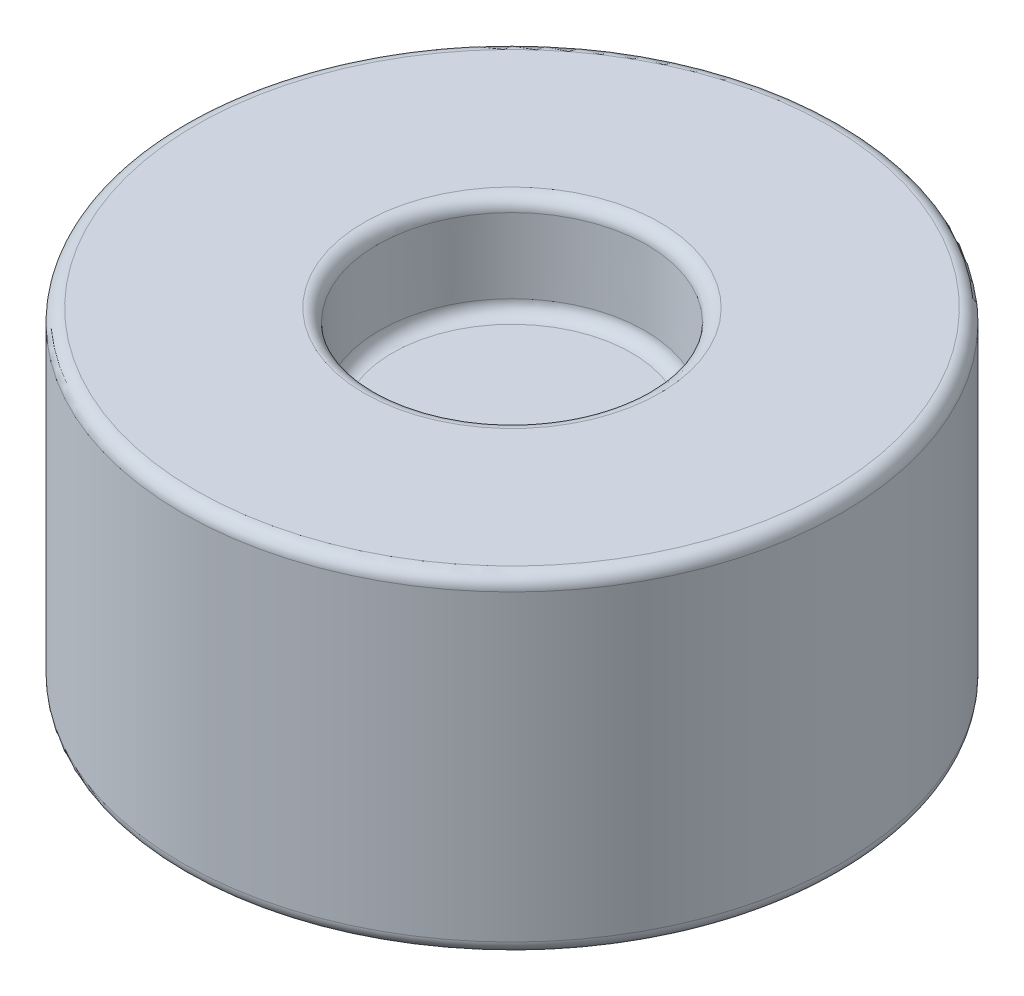
from build123d import *

# Parameters (mm, degrees)
SKETCH1_R           = 5
BOSS_EXTRUDE1_DEPTH = 5
SKETCH2_R           = 2.05
CUT_EXTRUDE1_DEPTH  = 1.5
CUT_EXTRUDE1_DRAFT  = -1.55
FILLET1_R           = 0.2
FILLET2_R           = 0.2


with BuildPart() as part:
    # Sketch1 → Boss-Extrude1 (new body)
    with BuildSketch(Plane(origin=(0, 0, 0), x_dir=(1, 0, 0), z_dir=(0, 1, 0))):
        Circle(SKETCH1_R)
    extrude(amount=BOSS_EXTRUDE1_DEPTH)


with BuildPart() as cut_extrude1_tool:
    # Sketch2 → Cut-Extrude1 (with draft: the straight prism first)
    with BuildSketch(Plane(origin=(0, 5, 0), x_dir=(1, 0, 0), z_dir=(0, 1, 0))):
        Circle(SKETCH2_R)
    extrude(amount=-CUT_EXTRUDE1_DEPTH)
    # Cut-Extrude1: the draft: its side faces are tilted about the plane it starts from
    cut_extrude1_sides = [cut_extrude1_tool.faces().sort_by_distance(p)[0] for p in [
        (-2.05, 4.25, 0),
    ]]
    draft(cut_extrude1_sides, Plane(origin=(0, 5, 0), x_dir=(1, 0, 0), z_dir=(0, 1, 0)), CUT_EXTRUDE1_DRAFT)


with BuildPart() as part_1:
    add(part.part)

    # Cut-Extrude1: cut by cut_extrude1_tool
    add(cut_extrude1_tool.part, mode=Mode.SUBTRACT)

    # Fillet1
    fillet1_edges = [part_1.edges().sort_by_distance(p)[0] for p in [
        (-5, 0, 0),
        (-5, 5, 0),
        (-2.05, 5, 0),
    ]]
    fillet(fillet1_edges, radius=FILLET1_R)

    # Fillet2
    fillet2_edges = [part_1.edges().sort_by_distance(p)[0] for p in [
        (-2.009411193, 3.5, 0),
    ]]
    fillet(fillet2_edges, radius=FILLET2_R)


solid = part_1.part
